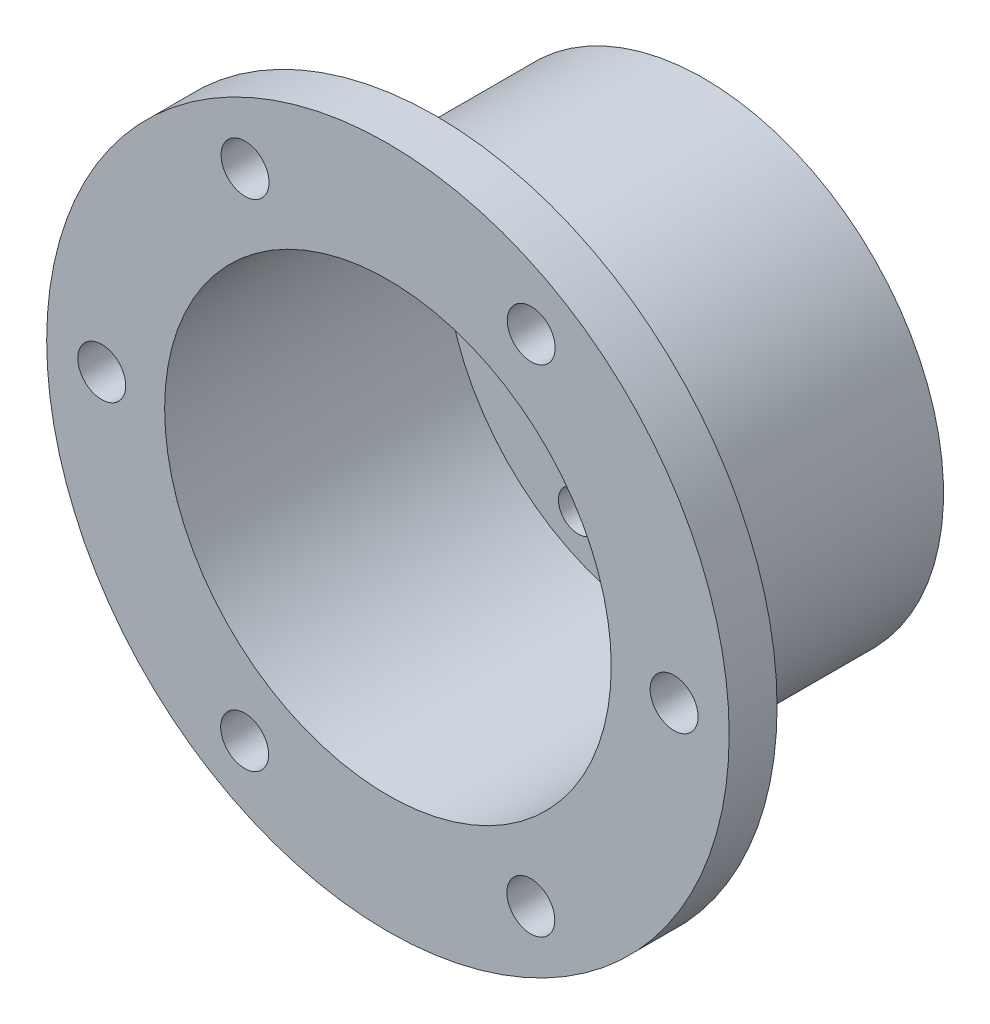
from build123d import *

# Parameters (mm, degrees)
CROQUIS1_R              = 21.4
CROQUIS1_R_2            = 18.65
SALIENTE_EXTRUIR1_DEPTH = 26.4
CROQUIS2_R              = 18.65
SALIENTE_EXTRUIR2_DEPTH = 3
SALIENTE_EXTRUIR3_START = -4
CROQUIS3_R              = 28.5
CROQUIS3_R_2            = 21.4
SALIENTE_EXTRUIR3_DEPTH = 4
CROQUIS4_R              = 6.15
CROQUIS4_R_2            = 1.65
CORTAR_EXTRUIR1_DEPTH   = 3
CROQUIS6_R              = 2
CORTAR_EXTRUIR2_DEPTH   = 49.181531732
CROQUIS7_R              = 21.4
CROQUIS7_R_2            = 20
CORTAR_EXTRUIR3_DEPTH   = 22.4
REDONDEO1_R             = 1


with BuildPart() as part:
    # Croquis1 → Saliente-Extruir1 (new body)
    with BuildSketch(Plane.XY):
        Circle(CROQUIS1_R)
        Circle(CROQUIS1_R_2, mode=Mode.SUBTRACT)
    extrude(amount=SALIENTE_EXTRUIR1_DEPTH)

    # Croquis2 → Saliente-Extruir2 (add)
    with BuildSketch(Plane(origin=(0, 0, 0), x_dir=(-1, 0, 0), z_dir=(0, 0, -1))):
        Circle(CROQUIS2_R)
    extrude(amount=-SALIENTE_EXTRUIR2_DEPTH)

    # Croquis3 → Saliente-Extruir3 (add)
    with BuildSketch(Plane.XY.offset(26.4).offset(SALIENTE_EXTRUIR3_START)):
        Circle(CROQUIS3_R)
        Circle(CROQUIS3_R_2, mode=Mode.SUBTRACT)
    extrude(amount=SALIENTE_EXTRUIR3_DEPTH)

    # Croquis4 → Cortar-Extruir1 (cut)
    with BuildSketch(Plane(origin=(0, 0, 0), x_dir=(-1, 0, 0), z_dir=(0, 0, -1))):
        with Locations((0, -7)):
            Circle(CROQUIS4_R)
        with Locations((-15.497639275, 0.2705123)):
            Circle(CROQUIS4_R_2)
        with Locations((-7.514549114, 13.556605461)):
            Circle(CROQUIS4_R_2)
        with Locations((7.983090161, 13.286093161)):
            Circle(CROQUIS4_R_2)
        with Locations((15.497639275, -0.2705123)):
            Circle(CROQUIS4_R_2)
        with Locations((7.514549114, -13.556605461)):
            Circle(CROQUIS4_R_2)
        with Locations((-7.983090161, -13.286093161)):
            Circle(CROQUIS4_R_2)
    extrude(amount=-CORTAR_EXTRUIR1_DEPTH, mode=Mode.SUBTRACT)

    # Croquis6 → Cortar-Extruir2 (cut, through all)
    with BuildSketch(Plane.XY.offset(26.4)):
        with Locations((11.96671541, 20.688356504)):
            Circle(CROQUIS6_R)
        with Locations((23.9, -0.019301293)):
            Circle(CROQUIS6_R)
        with Locations((-11.93328459, 20.707657797)):
            Circle(CROQUIS6_R)
        with Locations((11.93328459, -20.707657797)):
            Circle(CROQUIS6_R)
        with Locations((-11.96671541, -20.688356504)):
            Circle(CROQUIS6_R)
        with Locations((-23.9, 0.019301293)):
            Circle(CROQUIS6_R)
    extrude(amount=-CORTAR_EXTRUIR2_DEPTH, mode=Mode.SUBTRACT)

    # Croquis7 → Cortar-Extruir3 (cut)
    with BuildSketch(Plane(origin=(0, 0, 0), x_dir=(-1, 0, 0), z_dir=(0, 0, -1))):
        Circle(CROQUIS7_R)
        Circle(CROQUIS7_R_2, mode=Mode.SUBTRACT)
    extrude(amount=-CORTAR_EXTRUIR3_DEPTH, mode=Mode.SUBTRACT)

    # Redondeo1
    redondeo1_edges = [part.edges().sort_by_distance(p)[0] for p in [
        (20, 0, 22.4),
    ]]
    fillet(redondeo1_edges, radius=REDONDEO1_R)


solid = part.part
